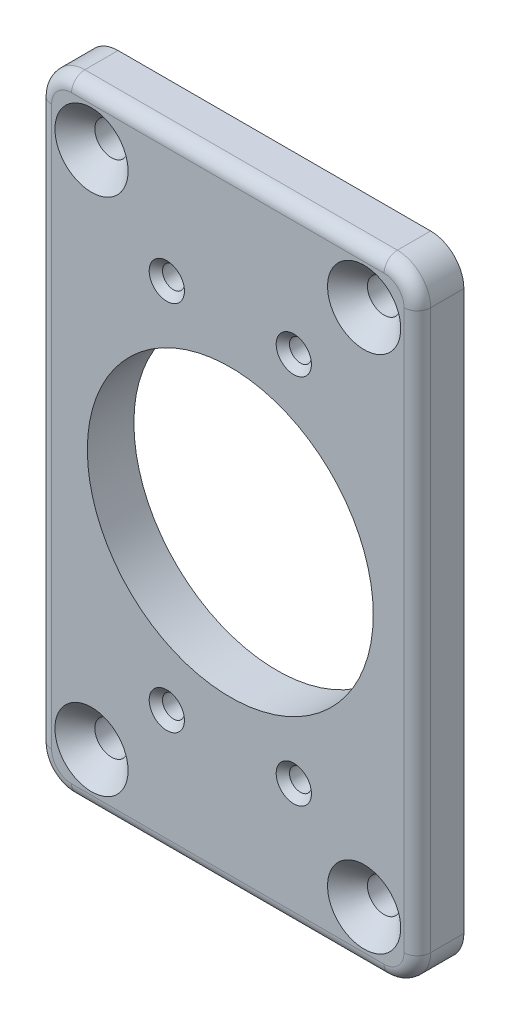
from build123d import *

# Parameters (mm, degrees)
SKETCH1_W           = 57
SKETCH1_H           = 94
SKETCH1_R           = 2.5
SKETCH1_R_2         = 1.65
BOSS_EXTRUDE1_DEPTH = 7
CHAMFER1_SIZE       = 3
FILLET1_R           = 5
FILLET2_R           = 2
CHAMFER2_SIZE       = 1
CUT_EXTRUDE1_DEPTH  = 10


with BuildPart() as part:
    # Sketch1 → Boss-Extrude1 (new body)
    with BuildSketch(Plane.XY):
        with Locations((-18.5, -37)):
            Rectangle(SKETCH1_W, SKETCH1_H)
        with Locations((-39, -76.0375)):
            Circle(SKETCH1_R, mode=Mode.SUBTRACT)
        with BuildLine():
            ThreePointArc((-26.025, -65.25), (-28.841726189, -66.416726189), (-27.675, -63.6))
            ThreePointArc((-27.675, -63.6), (-26.508273811, -64.083273811), (-26.025, -65.25))
        make_face(mode=Mode.SUBTRACT)
        with Locations((-8.575, -65.25)):
            Circle(SKETCH1_R_2, mode=Mode.SUBTRACT)
        with Locations((2, -76.0375)):
            Circle(SKETCH1_R, mode=Mode.SUBTRACT)
        with BuildLine():
            ThreePointArc((-26.025, -9.35), (-26.508273811, -10.516726189), (-27.675, -11))
            ThreePointArc((-27.675, -11), (-28.841726189, -8.183273811), (-26.025, -9.35))
        make_face(mode=Mode.SUBTRACT)
        with Locations((-8.575, -9.35)):
            Circle(SKETCH1_R_2, mode=Mode.SUBTRACT)
        with Locations((2, 2.0375)):
            Circle(SKETCH1_R, mode=Mode.SUBTRACT)
        with Locations((-39, 2.0375)):
            Circle(SKETCH1_R, mode=Mode.SUBTRACT)
    extrude(amount=BOSS_EXTRUDE1_DEPTH)

    # Chamfer1
    chamfer1_edges = [part.edges().sort_by_distance(p)[0] for p in [
        (-0.5, -76.0375, 7),
        (-41.5, -76.0375, 7),
        (-0.5, 2.0375, 7),
        (-41.5, 2.0375, 7),
    ]]
    chamfer(chamfer1_edges, length=CHAMFER1_SIZE)

    # Fillet1
    fillet1_edges = [part.edges().sort_by_distance(p)[0] for p in [
        (10, 10, 3.5),
        (10, -84, 3.5),
        (-47, -84, 3.5),
        (-47, 10, 3.5),
    ]]
    fillet(fillet1_edges, radius=FILLET1_R)

    # Fillet2
    fillet2_edges = [part.edges().sort_by_distance(p)[0] for p in [
        (-18.5, 10, 7),
        (10, -37, 7),
        (-47, -37, 7),
        (-18.5, -84, 7),
        (8.535533906, -82.535533906, 7),
        (-45.535533906, -82.535533906, 7),
        (-45.535533906, 8.535533906, 7),
        (8.535533906, 8.535533906, 7),
    ]]
    fillet(fillet2_edges, radius=FILLET2_R)

    # Chamfer2
    chamfer2_edges = [part.edges().sort_by_distance(p)[0] for p in [
        (-29.325, -9.35, 7),
        (-10.225, -65.25, 7),
        (-27.675, -66.9, 7),
        (-10.225, -9.35, 7),
    ]]
    chamfer(chamfer2_edges, length=CHAMFER2_SIZE)

    # Sketch3 → Cut-Extrude1 (cut)
    with BuildSketch(Plane.XY.offset(7)):
        with BuildLine():
            Line((-27.675, -56.562593283), (-27.675, -18.037406717))
            ThreePointArc((-27.675, -18.037406717), (-39.625, -37.3), (-27.675, -56.562593283))
        make_face()
        with BuildLine():
            ThreePointArc((-8.575, -18.037406717), (-18.125, -15.8), (-27.675, -18.037406717))
            Line((-27.675, -18.037406717), (-27.675, -56.562593283))
            ThreePointArc((-27.675, -56.562593283), (-18.125, -58.8), (-8.575, -56.562593283))
            Line((-8.575, -56.562593283), (-8.575, -18.037406717))
        make_face()
        with BuildLine():
            ThreePointArc((3.375, -37.3), (0.144852216, -25.965870126), (-8.575, -18.037406717))
            Line((-8.575, -18.037406717), (-8.575, -56.562593283))
            ThreePointArc((-8.575, -56.562593283), (0.144852216, -48.634129874), (3.375, -37.3))
        make_face()
    extrude(amount=-CUT_EXTRUDE1_DEPTH, mode=Mode.SUBTRACT)


solid = part.part
